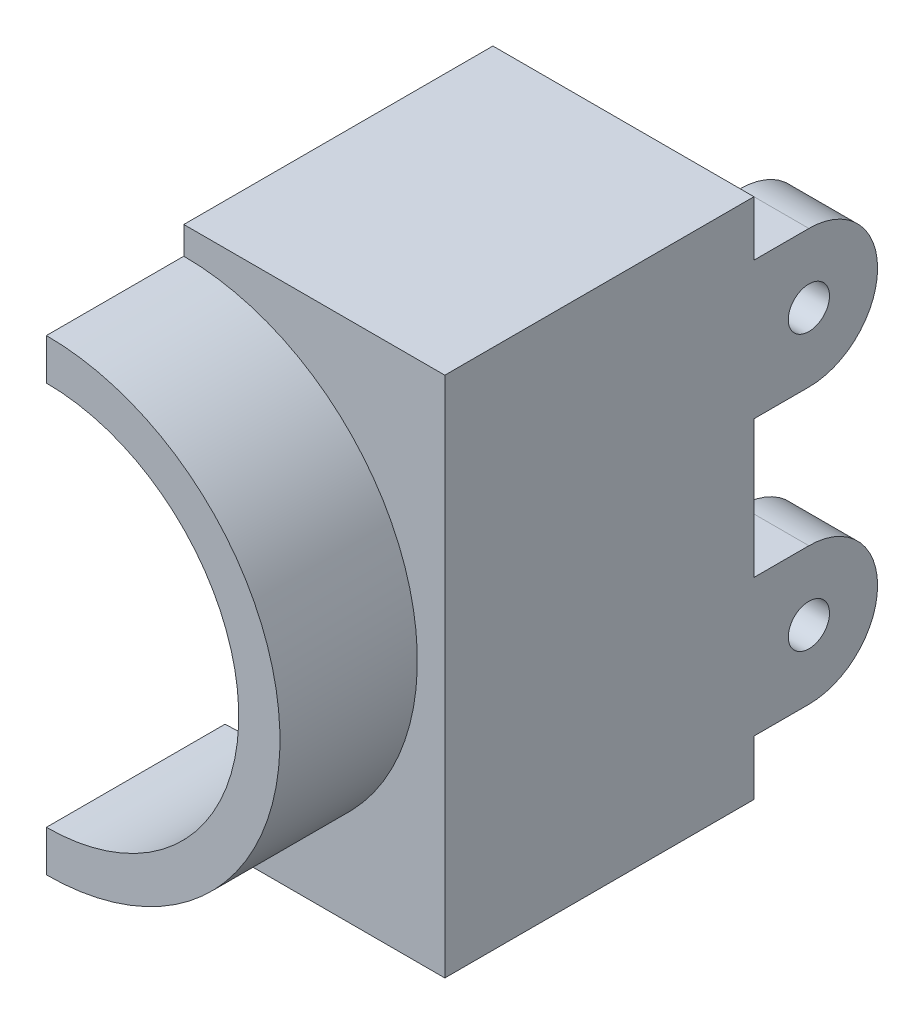
from build123d import *

# Parameters (mm, degrees)
SKETCH_1_R               = 17
SKETCH_1_R_2             = 14
EXTRUDE_1_DEPTH          = 10
SKETCH_2_W               = 38
SKETCH_2_H               = 38
EXTRUDE_2_DEPTH          = 22.5
SKETCH_3_W               = 32
SKETCH_3_H               = 32
CUT_EXTRUDE_1_DEPTH      = 19.5
SKETCH_4_R               = 14
CUT_EXTRUDE_2_DEPTH      = 36.046397818
SKETCH_5_W               = 38
SKETCH_5_H               = 38
SKETCH_5_W_2             = 12.1
SKETCH_5_H_2             = 11.16
EXTRUDE_3_DEPTH          = 3
SKETCH_6_R               = 1.5
EXTRUDE_4_DEPTH          = 3
SKETCH_7_R               = 1.5
EXTRUDE_5_DEPTH          = 5
CUT_EXTRUDE_3_DEPTH      = 2
CUT_EXTRUDE_5_DEPTH      = 43.16930163
CUT_EXTRUDE_5_DEPTH_BACK = 43.16930163
SKETCH_9_W               = 31.856814276
SKETCH_9_H               = 55.588041179


with BuildPart() as part:
    # 草图1 → 凸台-拉伸1 (new body)
    with BuildSketch(Plane.XY):
        Circle(SKETCH_1_R)
        Circle(SKETCH_1_R_2, mode=Mode.SUBTRACT)
    extrude(amount=EXTRUDE_1_DEPTH)

    # 草图2 → 凸台-拉伸2 (add)
    with BuildSketch(Plane(origin=(0, 0, 0), x_dir=(-1, 0, 0), z_dir=(0, 0, -1))):
        Rectangle(SKETCH_2_W, SKETCH_2_H)
    extrude(amount=EXTRUDE_2_DEPTH)

    # 草图3 → 切除-拉伸1 (cut)
    with BuildSketch(Plane(origin=(0, 0, -22.5), x_dir=(-1, 0, 0), z_dir=(0, 0, -1))):
        Rectangle(SKETCH_3_W, SKETCH_3_H)
    extrude(amount=-CUT_EXTRUDE_1_DEPTH, mode=Mode.SUBTRACT)

    # 草图4 → 切除-拉伸2 (cut, through all)
    with BuildSketch(Plane.XY):
        Circle(SKETCH_4_R)
    extrude(amount=-CUT_EXTRUDE_2_DEPTH, mode=Mode.SUBTRACT)

    # 草图5 → 凸台-拉伸3 (add)
    with BuildSketch(Plane(origin=(0, 0, -22.5), x_dir=(-1, 0, 0), z_dir=(0, 0, -1))):
        Rectangle(SKETCH_5_W, SKETCH_5_H)
        with Locations((1.55, -10.42)):
            Rectangle(SKETCH_5_W_2, SKETCH_5_H_2, mode=Mode.SUBTRACT)
    extrude(amount=-EXTRUDE_3_DEPTH)

    # 草图6 → 凸台-拉伸4 (add, symmetric)
    with BuildSketch(Plane(origin=(0, 0, 0), x_dir=(0, 0, -1), z_dir=(1, 0, 0))):
        with BuildLine():
            Line((22.5, 4.5), (25.5, 4.5))
            ThreePointArc((25.5, 4.5), (30, 0), (25.5, -4.5))
            Line((25.5, -4.5), (22.5, -4.5))
            Line((22.5, -4.5), (22.5, 4.5))
        make_face()
        with Locations((25.5, 0)):
            Circle(SKETCH_6_R, mode=Mode.SUBTRACT)
    extrude(amount=EXTRUDE_4_DEPTH, both=True)

    # 草图7 → 凸台-拉伸5 (add)
    # profile 1 of 2: a face of its own
    with BuildSketch(Plane(origin=(19, 0, 0), x_dir=(0, 0, -1), z_dir=(1, 0, 0))):
        with BuildLine():
            Line((22.5, 15), (26.5, 15))
            ThreePointArc((26.5, 15), (31.5, 10), (26.5, 5))
            Line((26.5, 5), (22.5, 5))
            Line((22.5, 5), (22.5, 15))
        make_face()
        with Locations((26.5, 10)):
            Circle(SKETCH_7_R, mode=Mode.SUBTRACT)
    # profile 2 of 2: a face of its own
    with BuildSketch(Plane(origin=(19, 0, 0), x_dir=(0, 0, -1), z_dir=(1, 0, 0))):
        with BuildLine():
            Line((22.5, -5), (22.5, -15))
            Line((22.5, -15), (26.5, -15))
            ThreePointArc((26.5, -15), (31.5, -10), (26.5, -5))
            Line((26.5, -5), (22.5, -5))
        make_face()
        with Locations(Location((26.5, -10, 0), (0, 0, 180))):
            Circle(SKETCH_7_R, mode=Mode.SUBTRACT)
    extrude_5 = extrude(amount=-EXTRUDE_5_DEPTH)

    # 草图8 → 切除-拉伸3 (cut)
    with BuildSketch(Plane.ZY.offset(-14)):
        Polygon((-26.5, 6.824573519), (-23.75, 8.41228676), (-23.75, 11.58771324), (-26.5, 13.175426481), (-29.25, 11.58771324), (-29.25, 8.41228676), align=None)
        Polygon((-29.25, -8.41228676), (-26.5, -6.824573519), (-23.75, -8.41228676), (-23.75, -11.58771324), (-26.5, -13.175426481), (-29.25, -11.58771324), align=None)
    cut_extrude_3 = extrude(amount=-CUT_EXTRUDE_3_DEPTH, mode=Mode.SUBTRACT)

    # 镜向1: 凸台-拉伸5, 切除-拉伸3 across plane
    add(extrude_5.mirror(Plane(origin=(0, 0, 0), x_dir=(0, 0, 1), z_dir=(1, 0, 0))))
    add(cut_extrude_3.mirror(Plane(origin=(0, 0, 0), x_dir=(0, 0, 1), z_dir=(1, 0, 0))), mode=Mode.SUBTRACT)

    # 草图9 → 切除-拉伸5 (cut, two sides: drawn at the far end of the back side and taken through both)
    with BuildSketch(Plane(origin=(0, 0, -22.5), x_dir=(-1, 0, 0), z_dir=(0, 0, -1)).offset(-CUT_EXTRUDE_5_DEPTH_BACK)):
        with Locations((15.928407138, -0.196580563)):
            Rectangle(SKETCH_9_W, SKETCH_9_H)
    extrude(amount=CUT_EXTRUDE_5_DEPTH + CUT_EXTRUDE_5_DEPTH_BACK, mode=Mode.SUBTRACT)


solid = part.part
